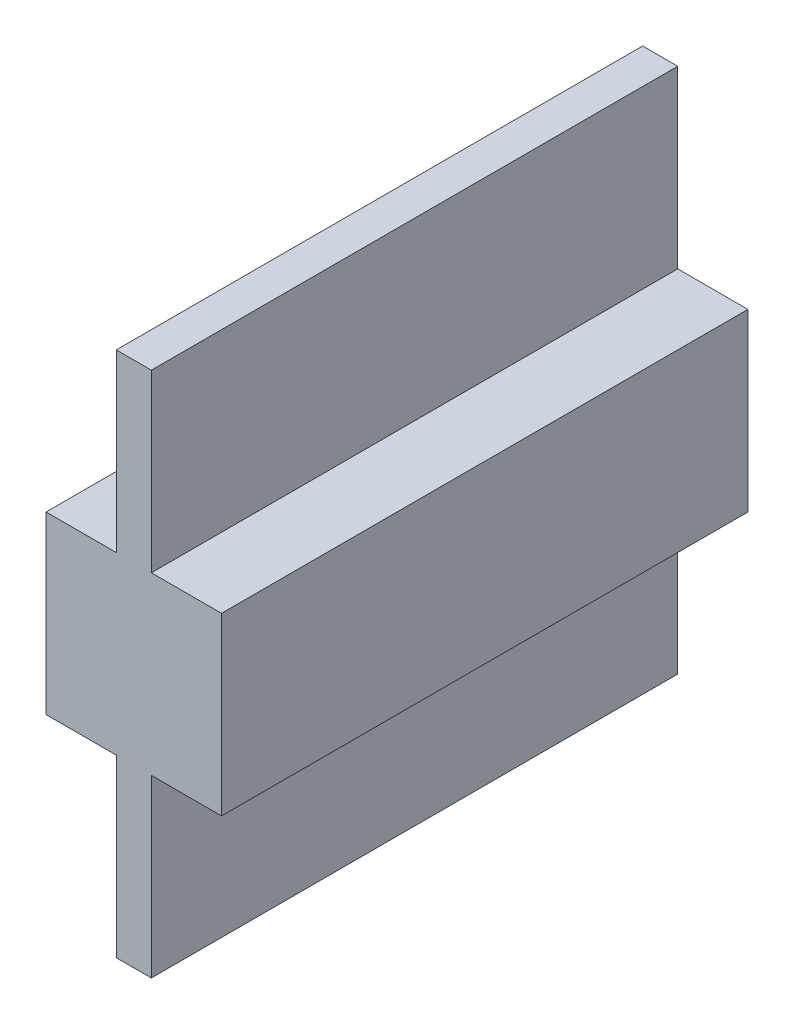
from build123d import *

# Parameters (mm, degrees)
SKETCH3_W           = 300
SKETCH3_H           = 100
BOSS_EXTRUDE3_DEPTH = 50
SKETCH3_4_W         = 300
SKETCH3_4_H         = 100
BOSS_EXTRUDE4_DEPTH = 10


with BuildPart() as part:
    # Sketch3 → Boss-Extrude3 (new, symmetric)
    with BuildSketch(Plane(origin=(0, 0, 0), x_dir=(0, 0, -1), z_dir=(1, 0, 0))):
        Rectangle(SKETCH3_W, SKETCH3_H)
    extrude(amount=BOSS_EXTRUDE3_DEPTH, both=True)

    # Sketch3<4> → Boss-Extrude4 (add, symmetric)
    with BuildSketch(Plane(origin=(0, 0, 0), x_dir=(0, 0, -1), z_dir=(1, 0, 0))):
        with Locations((0, 100)):
            Rectangle(SKETCH3_4_W, SKETCH3_4_H)
        with Locations((0, -100)):
            Rectangle(SKETCH3_4_W, SKETCH3_4_H)
    extrude(amount=BOSS_EXTRUDE4_DEPTH, both=True)


solid = part.part
